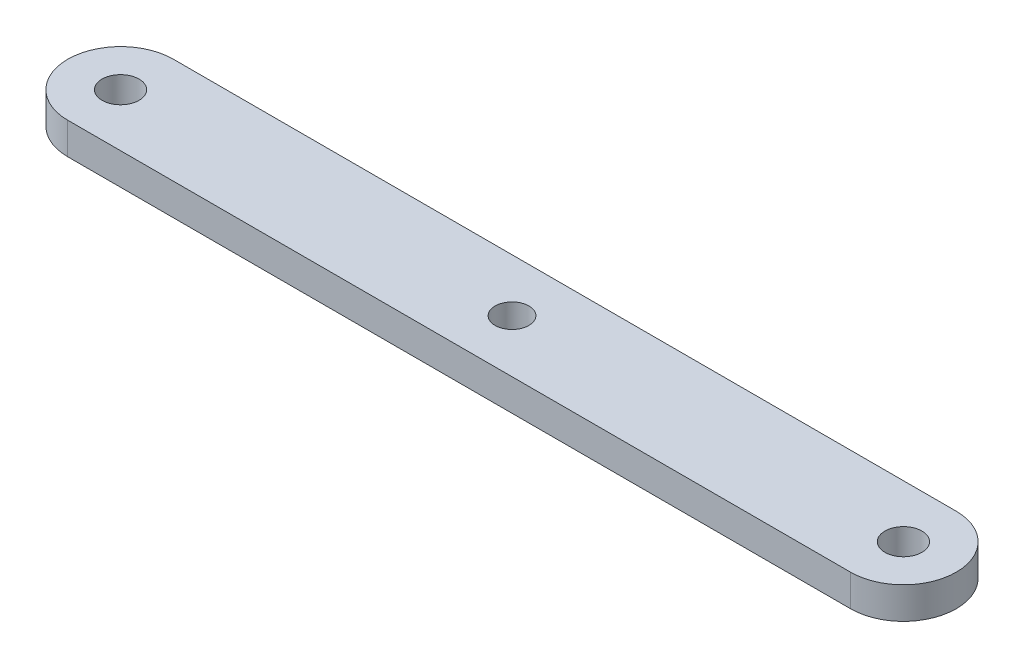
from build123d import *

# Parameters (mm, degrees)
SKETCH1_R           = 1.6
SKETCH1_R_2         = 1.75
BOSS_EXTRUDE1_DEPTH = 3


with BuildPart() as part:
    # Sketch1 → Boss-Extrude1 (new body)
    with BuildSketch(Plane(origin=(0, 0, 0), x_dir=(1, 0, 0), z_dir=(0, 1, 0))):
        with BuildLine():
            Line((-37.051716829, -20), (37.051716829, -20))
            ThreePointArc((37.051716829, -20), (42.051716829, -25), (37.051716829, -30))
            Line((37.051716829, -30), (-37.051716829, -30))
            ThreePointArc((-37.051716829, -30), (-42.051716829, -25), (-37.051716829, -20))
        make_face()
        with Locations(Location((0, -25, 0), (0, 0, 270))):
            Circle(SKETCH1_R, mode=Mode.SUBTRACT)
        with Locations(Location((37.051716829, -25, 0), (0, 0, 270))):
            Circle(SKETCH1_R_2, mode=Mode.SUBTRACT)
        with Locations(Location((-37.051716829, -25, 0), (0, 0, 90))):
            Circle(SKETCH1_R_2, mode=Mode.SUBTRACT)
    extrude(amount=BOSS_EXTRUDE1_DEPTH)


solid = part.part
